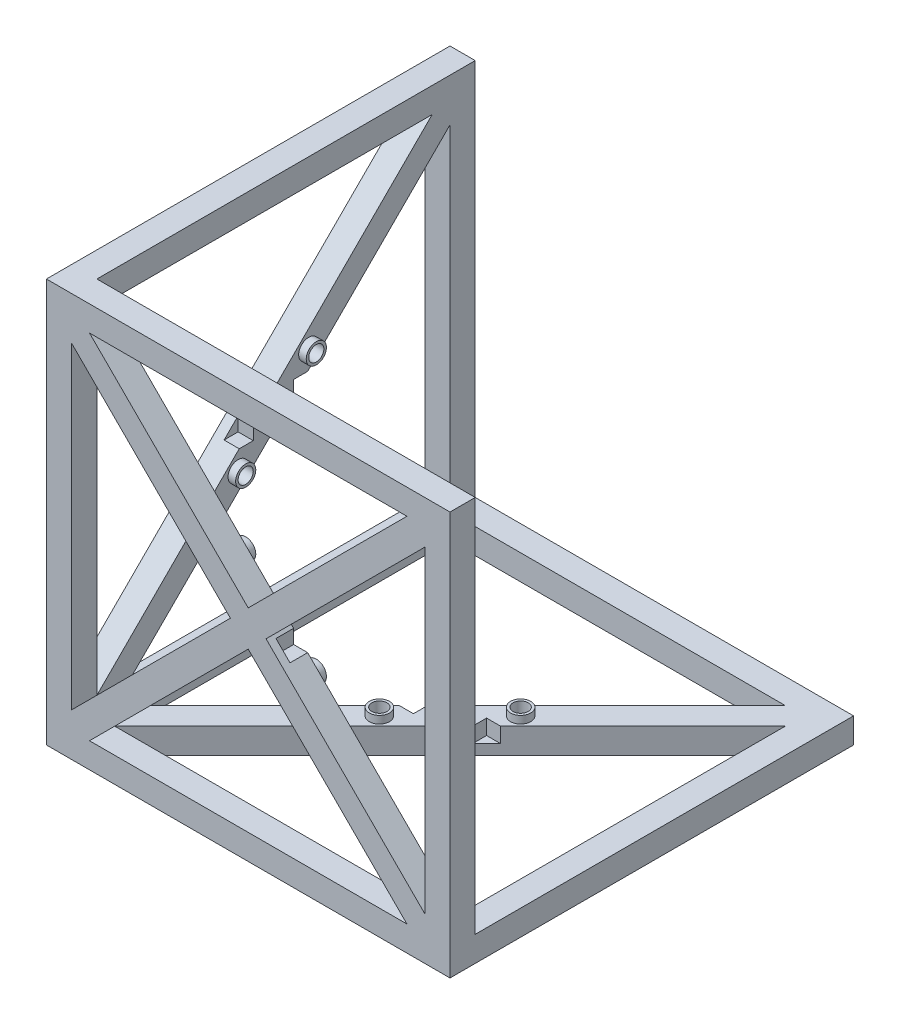
from build123d import *

# Parameters (mm, degrees)
SKETCH_1_W          = 80
SKETCH_1_H          = 80
SKETCH_1_W_2        = 70
SKETCH_1_H_2        = 70
EXTRUDE_1_DEPTH     = 5
SKETCH_2_W          = 5
SKETCH_2_H          = 5
EXTRUDE_2_DEPTH     = 75
SKETCH_4_W          = 5
SKETCH_4_H          = 5
EXTRUDE_3_DEPTH     = 70
EXTRUDE_4_DEPTH     = 5
SKETCH_7_W          = 5
SKETCH_7_H          = 5
EXTRUDE_5_DEPTH     = 70
EXTRUDE_6_DEPTH     = 5
SKETCH_11_R         = 2
SKETCH_11_R_2       = 1.5
EXTRUDE_7_DEPTH     = 1.5
CUT_EXTRUDE_START   = -3
SKETCH_11_2_R       = 1.5
CUT_EXTRUDE_1_DEPTH = 3
SKETCH_12_R         = 2
SKETCH_12_R_2       = 1.5
EXTRUDE_8_DEPTH     = 1.5
CUT_EXTRUDE_START_2 = -3.5
SKETCH_12_2_R       = 1.5
CUT_EXTRUDE_2_DEPTH = 3.5
SKETCH_13_R         = 2
SKETCH_13_R_2       = 1.5
EXTRUDE_9_DEPTH     = 1.5
SKETCH_13_2_R       = 1.5
CUT_EXTRUDE_3_DEPTH = 3


with BuildPart() as part:
    # 草图1 → 凸台-拉伸1 (new body)
    # profile 1 of 6: a face of its own
    with BuildSketch(Plane(origin=(0, 0, 0), x_dir=(1, 0, 0), z_dir=(0, 1, 0))):
        with Locations((40, 40)):
            Rectangle(SKETCH_1_W, SKETCH_1_H)
        with Locations((40, 40)):
            Rectangle(SKETCH_1_W_2, SKETCH_1_H_2, mode=Mode.SUBTRACT)
    # profile 2 of 6: a face of its own
    with BuildSketch(Plane(origin=(0, 0, 0), x_dir=(1, 0, 0), z_dir=(0, 1, 0))):
        Polygon((5, 8.535533906), (5, 5), (8.535533906, 5), (40, 36.464466094), (36.464466094, 40), align=None)
    # profile 3 of 6: a face of its own
    with BuildSketch(Plane(origin=(0, 0, 0), x_dir=(1, 0, 0), z_dir=(0, 1, 0))):
        Polygon((40, 36.464466094), (71.464466094, 5), (75, 5), (75, 8.535533906), (43.535533906, 40), align=None)
    # profile 4 of 6: a face of its own
    with BuildSketch(Plane(origin=(0, 0, 0), x_dir=(1, 0, 0), z_dir=(0, 1, 0))):
        Polygon((40, 43.535533906), (43.535533906, 40), (75, 71.464466094), (75, 75), (71.464466094, 75), align=None)
    # profile 5 of 6: a face of its own
    with BuildSketch(Plane(origin=(0, 0, 0), x_dir=(1, 0, 0), z_dir=(0, 1, 0))):
        Polygon((5, 75), (5, 71.464466094), (36.464466094, 40), (40, 43.535533906), (8.535533906, 75), align=None)
    # profile 6 of 6: a face of its own
    with BuildSketch(Plane(origin=(0, 0, 0), x_dir=(1, 0, 0), z_dir=(0, 1, 0))):
        Polygon((36.464466094, 40), (40, 36.464466094), (43.535533906, 40), (40, 43.535533906), align=None)
    extrude(amount=EXTRUDE_1_DEPTH)

    # 草图2 → 凸台-拉伸2 (add)
    with BuildSketch(Plane(origin=(0, 5, 0), x_dir=(1, 0, 0), z_dir=(0, 1, 0))):
        with Locations((2.5, 2.5)):
            Rectangle(SKETCH_2_W, SKETCH_2_H)
        with Locations((77.5, 2.5)):
            Rectangle(SKETCH_2_W, SKETCH_2_H)
        with Locations((2.5, 77.5)):
            Rectangle(SKETCH_2_W, SKETCH_2_H)
    extrude(amount=EXTRUDE_2_DEPTH)

    # 草图4 → 凸台-拉伸3 (add)
    with BuildSketch(Plane(origin=(5, 0, 0), x_dir=(0, 0, -1), z_dir=(1, 0, 0))):
        with Locations((2.5, 77.5)):
            Rectangle(SKETCH_4_W, SKETCH_4_H)
    extrude(amount=EXTRUDE_3_DEPTH)

    # 草图6 → 凸台-拉伸4 (add)
    with BuildSketch(Plane.XY):
        Polygon((5, 75), (5, 71.464466094), (36.464466094, 40), (40, 43.535533906), (8.535533906, 75), align=None)
        Polygon((40, 43.535533906), (43.535533906, 40), (75, 71.464466094), (75, 75), (71.464466094, 75), align=None)
        Polygon((5, 8.535533906), (5, 5), (8.535533906, 5), (40, 36.464466094), (36.464466094, 40), align=None)
        Polygon((36.464466094, 40), (40, 36.464466094), (43.535533906, 40), (40, 43.535533906), align=None)
        Polygon((40, 36.464466094), (71.464466094, 5), (75, 5), (75, 8.535533906), (43.535533906, 40), align=None)
    extrude(amount=-EXTRUDE_4_DEPTH)

    # 草图7 → 凸台-拉伸5 (add)
    with BuildSketch(Plane(origin=(0, 0, -5), x_dir=(-1, 0, 0), z_dir=(0, 0, -1))):
        with Locations((-2.5, 77.5)):
            Rectangle(SKETCH_7_W, SKETCH_7_H)
    extrude(amount=EXTRUDE_5_DEPTH)

    # 草图8 → 凸台-拉伸6 (add)
    with BuildSketch(Plane.ZY):
        Polygon((-5, 75), (-8.535533906, 75), (-40, 43.535533906), (-36.464466094, 40), (-5, 71.464466094), align=None)
        Polygon((-40, 43.535533906), (-43.535533906, 40), (-40, 36.464466094), (-36.464466094, 40), align=None)
        Polygon((-36.464466094, 40), (-40, 36.464466094), (-8.535533906, 5), (-5, 5), (-5, 8.535533906), align=None)
        Polygon((-71.464466094, 75), (-75, 75), (-75, 71.464466094), (-43.535533906, 40), (-40, 43.535533906), align=None)
        Polygon((-43.535533906, 40), (-75, 8.535533906), (-75, 5), (-71.464466094, 5), (-40, 36.464466094), align=None)
    extrude(amount=-EXTRUDE_6_DEPTH)

    # 草图11 → 凸台-拉伸7 (add)
    # profile 1 of 4: a face of its own
    with BuildSketch(Plane(origin=(0, 5, 0), x_dir=(1, 0, 0), z_dir=(0, 1, 0))):
        with Locations(Location((47, 47, 0), (0, 0, 270))):
            Circle(SKETCH_11_R)
        with Locations(Location((47, 47, 0), (0, 0, 270))):
            Circle(SKETCH_11_R_2, mode=Mode.SUBTRACT)
    # profile 2 of 4: a face of its own
    with BuildSketch(Plane(origin=(0, 5, 0), x_dir=(1, 0, 0), z_dir=(0, 1, 0))):
        with Locations(Location((47, 33, 0), (0, 0, 270))):
            Circle(SKETCH_11_R)
        with Locations(Location((47, 33, 0), (0, 0, 270))):
            Circle(SKETCH_11_R_2, mode=Mode.SUBTRACT)
    # profile 3 of 4: a face of its own
    with BuildSketch(Plane(origin=(0, 5, 0), x_dir=(1, 0, 0), z_dir=(0, 1, 0))):
        with Locations(Location((33, 33, 0), (0, 0, 270))):
            Circle(SKETCH_11_R)
        with Locations(Location((33, 33, 0), (0, 0, 270))):
            Circle(SKETCH_11_R_2, mode=Mode.SUBTRACT)
    # profile 4 of 4: a face of its own
    with BuildSketch(Plane(origin=(0, 5, 0), x_dir=(1, 0, 0), z_dir=(0, 1, 0))):
        with Locations(Location((33, 47, 0), (0, 0, 270))):
            Circle(SKETCH_11_R)
        with Locations(Location((33, 47, 0), (0, 0, 270))):
            Circle(SKETCH_11_R_2, mode=Mode.SUBTRACT)
    extrude(amount=EXTRUDE_7_DEPTH)

    # 草图11<2> → 切除-拉伸1 (cut)
    with BuildSketch(Plane(origin=(0, 5, 0), x_dir=(1, 0, 0), z_dir=(0, 1, 0)).offset(CUT_EXTRUDE_START)):
        with Locations(Location((33, 47, 0), (0, 0, 270))):
            Circle(SKETCH_11_2_R)
        with Locations(Location((33, 33, 0), (0, 0, 270))):
            Circle(SKETCH_11_2_R)
        Polygon((36, 39.535533906), (33.214466094, 36.75), (36, 36.75), align=None)
        Polygon((36, 43.25), (33.214466094, 43.25), (36, 40.464466094), align=None)
        Polygon((44, 40.464466094), (46.785533906, 43.25), (44, 43.25), align=None)
        Polygon((44, 36.75), (46.785533906, 36.75), (44, 39.535533906), align=None)
        with Locations(Location((47, 47, 0), (0, 0, 270))):
            Circle(SKETCH_11_2_R)
        with Locations(Location((47, 33, 0), (0, 0, 270))):
            Circle(SKETCH_11_2_R)
        with Locations(Location((40, 40, 0), (0, 0, 270))):
            Circle(SKETCH_11_2_R)
    extrude(amount=CUT_EXTRUDE_1_DEPTH, mode=Mode.SUBTRACT)

    # 草图12 → 凸台-拉伸8 (add)
    # profile 1 of 4: a face of its own
    with BuildSketch(Plane(origin=(0, 0, -5), x_dir=(-1, 0, 0), z_dir=(0, 0, -1))):
        with Locations(Location((-33, 47, 0), (0, 0, 180))):
            Circle(SKETCH_12_R)
        with Locations((-33, 47)):
            Circle(SKETCH_12_R_2, mode=Mode.SUBTRACT)
    # profile 2 of 4: a face of its own
    with BuildSketch(Plane(origin=(0, 0, -5), x_dir=(-1, 0, 0), z_dir=(0, 0, -1))):
        with Locations((-33, 33)):
            Circle(SKETCH_12_R)
        with Locations(Location((-33, 33, 0), (0, 0, 180))):
            Circle(SKETCH_12_R_2, mode=Mode.SUBTRACT)
    # profile 3 of 4: a face of its own
    with BuildSketch(Plane(origin=(0, 0, -5), x_dir=(-1, 0, 0), z_dir=(0, 0, -1))):
        with Locations(Location((-47, 33, 0), (0, 0, 180))):
            Circle(SKETCH_12_R)
        with Locations((-47, 33)):
            Circle(SKETCH_12_R_2, mode=Mode.SUBTRACT)
    # profile 4 of 4: a face of its own
    with BuildSketch(Plane(origin=(0, 0, -5), x_dir=(-1, 0, 0), z_dir=(0, 0, -1))):
        with Locations((-47, 47)):
            Circle(SKETCH_12_R)
        with Locations(Location((-47, 47, 0), (0, 0, 180))):
            Circle(SKETCH_12_R_2, mode=Mode.SUBTRACT)
    extrude(amount=EXTRUDE_8_DEPTH)

    # 草图12<2> → 切除-拉伸2 (cut)
    with BuildSketch(Plane(origin=(0, 0, -5), x_dir=(-1, 0, 0), z_dir=(0, 0, -1)).offset(CUT_EXTRUDE_START_2)):
        with Locations((-47, 33)):
            Circle(SKETCH_12_2_R)
        with Locations((-33, 33)):
            Circle(SKETCH_12_2_R)
        with Locations((-33, 47)):
            Circle(SKETCH_12_2_R)
        with Locations((-47, 47)):
            Circle(SKETCH_12_2_R)
        Polygon((-44, 43.25), (-46.785533906, 43.25), (-44, 40.464466094), align=None)
        Polygon((-44, 39.535533906), (-46.785533906, 36.75), (-44, 36.75), align=None)
        Polygon((-33.214466094, 36.75), (-36, 39.535533906), (-36, 36.75), align=None)
        Polygon((-33.214466094, 43.25), (-36, 43.25), (-36, 40.464466094), align=None)
        with Locations((-40, 40)):
            Circle(SKETCH_12_2_R)
    extrude(amount=CUT_EXTRUDE_2_DEPTH, mode=Mode.SUBTRACT)

    # 草图13 → 凸台-拉伸9 (add)
    # profile 1 of 4: a face of its own
    with BuildSketch(Plane(origin=(5, 0, 0), x_dir=(0, 0, -1), z_dir=(1, 0, 0))):
        with Locations((33, 47)):
            Circle(SKETCH_13_R)
        with Locations(Location((33, 47, 0), (0, 0, 180))):
            Circle(SKETCH_13_R_2, mode=Mode.SUBTRACT)
    # profile 2 of 4: a face of its own
    with BuildSketch(Plane(origin=(5, 0, 0), x_dir=(0, 0, -1), z_dir=(1, 0, 0))):
        with Locations(Location((47, 47, 0), (0, 0, 180))):
            Circle(SKETCH_13_R)
        with Locations((47, 47)):
            Circle(SKETCH_13_R_2, mode=Mode.SUBTRACT)
    # profile 3 of 4: a face of its own
    with BuildSketch(Plane(origin=(5, 0, 0), x_dir=(0, 0, -1), z_dir=(1, 0, 0))):
        with Locations(Location((33, 33, 0), (0, 0, 180))):
            Circle(SKETCH_13_R)
        with Locations((33, 33)):
            Circle(SKETCH_13_R_2, mode=Mode.SUBTRACT)
    # profile 4 of 4: a face of its own
    with BuildSketch(Plane(origin=(5, 0, 0), x_dir=(0, 0, -1), z_dir=(1, 0, 0))):
        with Locations((47, 33)):
            Circle(SKETCH_13_R)
        with Locations(Location((47, 33, 0), (0, 0, 180))):
            Circle(SKETCH_13_R_2, mode=Mode.SUBTRACT)
    extrude(amount=EXTRUDE_9_DEPTH)

    # 草图13<2> → 切除-拉伸3 (cut)
    with BuildSketch(Plane(origin=(5, 0, 0), x_dir=(0, 0, -1), z_dir=(1, 0, 0)).offset(CUT_EXTRUDE_START)):
        with Locations(Location((33, 33, 0), (0, 0, 180))):
            Circle(SKETCH_13_2_R)
        with Locations(Location((33, 47, 0), (0, 0, 180))):
            Circle(SKETCH_13_2_R)
        with Locations(Location((47, 47, 0), (0, 0, 180))):
            Circle(SKETCH_13_2_R)
        with Locations(Location((47, 33, 0), (0, 0, 180))):
            Circle(SKETCH_13_2_R)
        Polygon((36, 43.25), (33.214466094, 43.25), (36, 40.464466094), align=None)
        Polygon((36, 39.535533906), (33.214466094, 36.75), (36, 36.75), align=None)
        Polygon((46.785533906, 36.75), (44, 39.535533906), (44, 36.75), align=None)
        Polygon((46.785533906, 43.25), (44, 43.25), (44, 40.464466094), align=None)
        with Locations((40, 40)):
            Circle(SKETCH_13_2_R)
    extrude(amount=CUT_EXTRUDE_3_DEPTH, mode=Mode.SUBTRACT)


solid = part.part
